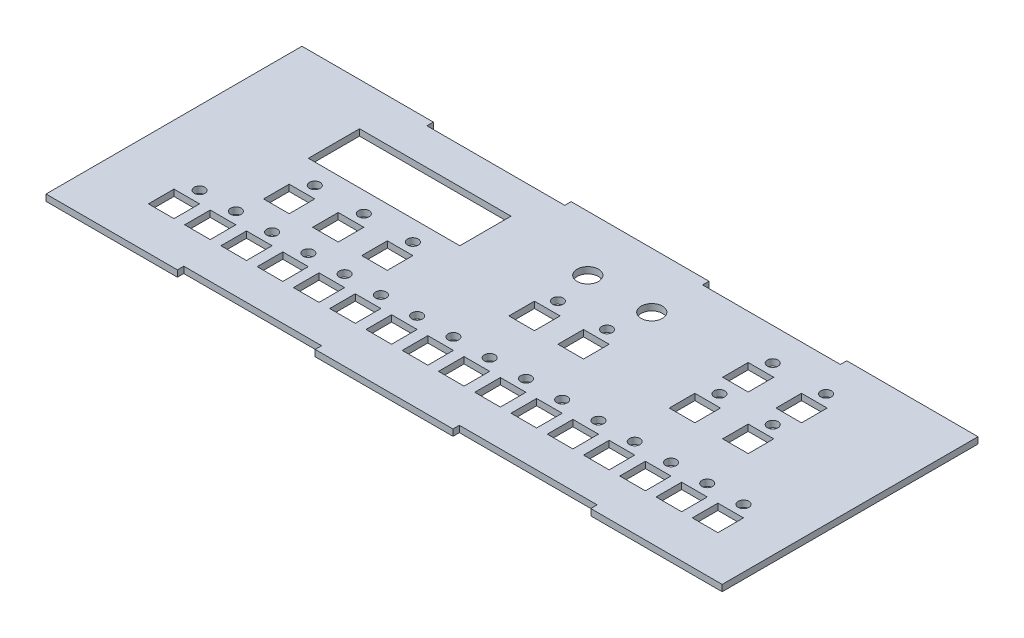
from build123d import *

# Parameters (mm, degrees)
SKETCH1_W           = 12
SKETCH1_H           = 12
SKETCH1_R           = 2.5
SKETCH1_W_2         = 71
SKETCH1_H_2         = 24
SKETCH1_R_2         = 5
BOSS_EXTRUDE1_DEPTH = 3


with BuildPart() as part:
    # Sketch1 → Boss-Extrude1 (new body)
    with BuildSketch(Plane(origin=(0, 0, 0), x_dir=(1, 0, 0), z_dir=(0, 1, 0))):
        Polygon((-28, -20), (33.6, -20), (33.6, -17), (98.2, -17), (98.2, -20), (162.8, -20), (162.8, -17), (227.4, -17), (227.4, -20), (289, -20), (289, 99.936143656), (227.417055149, 100), (227.417055149, 97), (162.817055149, 97), (162.817055149, 100), (98.2, 100), (98.2, 97), (33.6, 97), (33.6, 100), (-28, 100), align=None)
        with Locations((6, 6)):
            Rectangle(SKETCH1_W, SKETCH1_H, mode=Mode.SUBTRACT)
        with Locations((23, 6)):
            Rectangle(SKETCH1_W, SKETCH1_H, mode=Mode.SUBTRACT)
        with Locations((40, 6)):
            Rectangle(SKETCH1_W, SKETCH1_H, mode=Mode.SUBTRACT)
        with Locations((57, 6)):
            Rectangle(SKETCH1_W, SKETCH1_H, mode=Mode.SUBTRACT)
        with Locations((74, 6)):
            Rectangle(SKETCH1_W, SKETCH1_H, mode=Mode.SUBTRACT)
        with Locations((91, 6)):
            Rectangle(SKETCH1_W, SKETCH1_H, mode=Mode.SUBTRACT)
        with Locations((108, 6)):
            Rectangle(SKETCH1_W, SKETCH1_H, mode=Mode.SUBTRACT)
        with Locations((125, 6)):
            Rectangle(SKETCH1_W, SKETCH1_H, mode=Mode.SUBTRACT)
        with Locations(Location((6.5, 17.5, 0), (0, 0, 270))):
            Circle(SKETCH1_R, mode=Mode.SUBTRACT)
        with Locations(Location((23.5, 17.5, 0), (0, 0, 270))):
            Circle(SKETCH1_R, mode=Mode.SUBTRACT)
        with Locations(Location((40.5, 17.5, 0), (0, 0, 270))):
            Circle(SKETCH1_R, mode=Mode.SUBTRACT)
        with Locations((31, 35)):
            Rectangle(SKETCH1_W, SKETCH1_H, mode=Mode.SUBTRACT)
        with Locations(Location((57.5, 17.5, 0), (0, 0, 270))):
            Circle(SKETCH1_R, mode=Mode.SUBTRACT)
        with Locations(Location((74.5, 17.5, 0), (0, 0, 270))):
            Circle(SKETCH1_R, mode=Mode.SUBTRACT)
        with Locations(Location((91.5, 17.5, 0), (0, 0, 270))):
            Circle(SKETCH1_R, mode=Mode.SUBTRACT)
        with Locations(Location((108.5, 17.5, 0), (0, 0, 270))):
            Circle(SKETCH1_R, mode=Mode.SUBTRACT)
        with Locations(Location((125.5, 17.5, 0), (0, 0, 270))):
            Circle(SKETCH1_R, mode=Mode.SUBTRACT)
        with Locations((54, 35)):
            Rectangle(SKETCH1_W, SKETCH1_H, mode=Mode.SUBTRACT)
        with Locations((77, 35)):
            Rectangle(SKETCH1_W, SKETCH1_H, mode=Mode.SUBTRACT)
        with Locations((142, 6)):
            Rectangle(SKETCH1_W, SKETCH1_H, mode=Mode.SUBTRACT)
        with Locations((159, 6)):
            Rectangle(SKETCH1_W, SKETCH1_H, mode=Mode.SUBTRACT)
        with Locations((176, 6)):
            Rectangle(SKETCH1_W, SKETCH1_H, mode=Mode.SUBTRACT)
        with Locations((193, 6)):
            Rectangle(SKETCH1_W, SKETCH1_H, mode=Mode.SUBTRACT)
        with Locations((210, 6)):
            Rectangle(SKETCH1_W, SKETCH1_H, mode=Mode.SUBTRACT)
        with Locations((227, 6)):
            Rectangle(SKETCH1_W, SKETCH1_H, mode=Mode.SUBTRACT)
        with Locations((244, 6)):
            Rectangle(SKETCH1_W, SKETCH1_H, mode=Mode.SUBTRACT)
        with Locations((261, 6)):
            Rectangle(SKETCH1_W, SKETCH1_H, mode=Mode.SUBTRACT)
        with Locations(Location((142.5, 17.5, 0), (0, 0, 270))):
            Circle(SKETCH1_R, mode=Mode.SUBTRACT)
        with Locations(Location((159.5, 17.5, 0), (0, 0, 270))):
            Circle(SKETCH1_R, mode=Mode.SUBTRACT)
        with Locations(Location((176.5, 17.5, 0), (0, 0, 270))):
            Circle(SKETCH1_R, mode=Mode.SUBTRACT)
        with Locations(Location((193.5, 17.5, 0), (0, 0, 270))):
            Circle(SKETCH1_R, mode=Mode.SUBTRACT)
        with Locations(Location((210.5, 17.5, 0), (0, 0, 270))):
            Circle(SKETCH1_R, mode=Mode.SUBTRACT)
        with Locations(Location((227.5, 17.5, 0), (0, 0, 270))):
            Circle(SKETCH1_R, mode=Mode.SUBTRACT)
        with Locations(Location((244.5, 17.5, 0), (0, 0, 270))):
            Circle(SKETCH1_R, mode=Mode.SUBTRACT)
        with Locations(Location((261.5, 17.5, 0), (0, 0, 270))):
            Circle(SKETCH1_R, mode=Mode.SUBTRACT)
        with Locations(Location((31.5, 46.5, 0), (0, 0, 270))):
            Circle(SKETCH1_R, mode=Mode.SUBTRACT)
        with Locations(Location((54.5, 46.5, 0), (0, 0, 270))):
            Circle(SKETCH1_R, mode=Mode.SUBTRACT)
        with Locations(Location((77.5, 46.5, 0), (0, 0, 270))):
            Circle(SKETCH1_R, mode=Mode.SUBTRACT)
        with Locations((54.5, 68)):
            Rectangle(SKETCH1_W_2, SKETCH1_H_2, mode=Mode.SUBTRACT)
        with Locations((136, 45)):
            Rectangle(SKETCH1_W, SKETCH1_H, mode=Mode.SUBTRACT)
        with Locations((159, 45)):
            Rectangle(SKETCH1_W, SKETCH1_H, mode=Mode.SUBTRACT)
        with Locations(Location((135.5, 56.5, 0), (0, 0, 270))):
            Circle(SKETCH1_R, mode=Mode.SUBTRACT)
        with Locations(Location((158.5, 56.5, 0), (0, 0, 270))):
            Circle(SKETCH1_R, mode=Mode.SUBTRACT)
        with Locations((211, 45.2)):
            Rectangle(SKETCH1_W, SKETCH1_H, mode=Mode.SUBTRACT)
        with Locations((236, 45.2)):
            Rectangle(SKETCH1_W, SKETCH1_H, mode=Mode.SUBTRACT)
        with Locations(Location((211, 56.7, 0), (0, 0, 270))):
            Circle(SKETCH1_R, mode=Mode.SUBTRACT)
        with Locations(Location((236, 56.7, 0), (0, 0, 270))):
            Circle(SKETCH1_R, mode=Mode.SUBTRACT)
        with Locations(Location((132, 74, 0), (0, 0, 270))):
            Circle(SKETCH1_R_2, mode=Mode.SUBTRACT)
        with Locations(Location((162, 74, 0), (0, 0, 270))):
            Circle(SKETCH1_R_2, mode=Mode.SUBTRACT)
        with Locations((211, 70.2)):
            Rectangle(SKETCH1_W, SKETCH1_H, mode=Mode.SUBTRACT)
        with Locations((236, 70.2)):
            Rectangle(SKETCH1_W, SKETCH1_H, mode=Mode.SUBTRACT)
        with Locations(Location((211, 81.7, 0), (0, 0, 270))):
            Circle(SKETCH1_R, mode=Mode.SUBTRACT)
        with Locations(Location((236, 81.7, 0), (0, 0, 270))):
            Circle(SKETCH1_R, mode=Mode.SUBTRACT)
    extrude(amount=BOSS_EXTRUDE1_DEPTH)


solid = part.part
